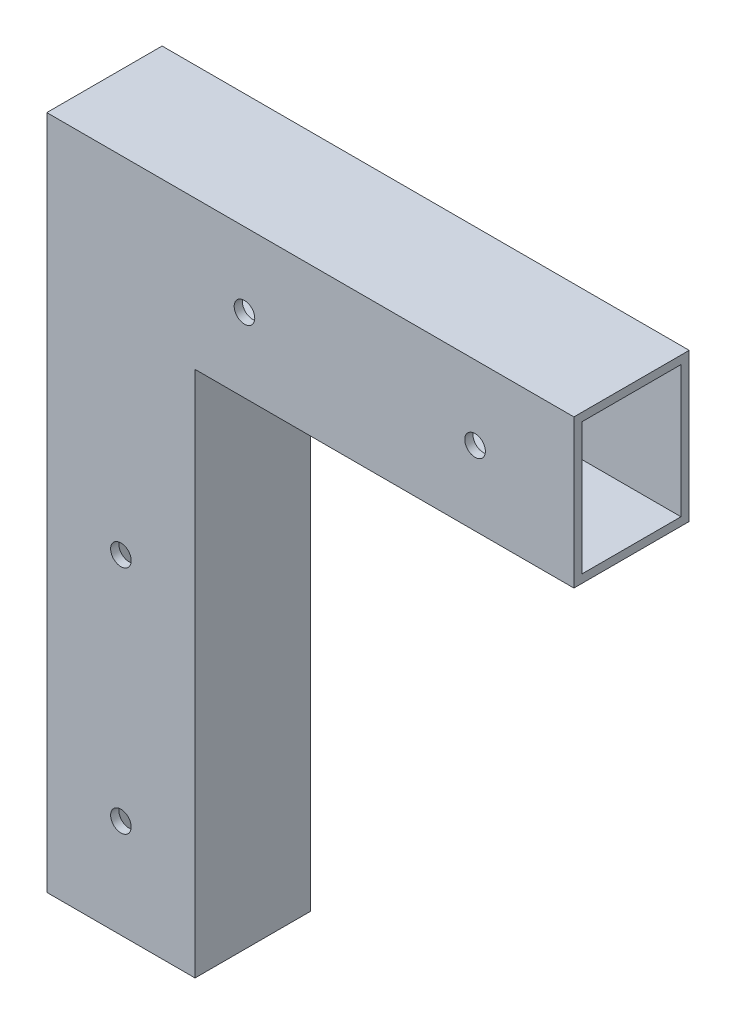
from build123d import *

# Parameters (mm, degrees)
SKETCH1_W           = 114.3
SKETCH1_H           = 406.4
BOSS_EXTRUDE1_DEPTH = 88.9
SKETCH2_W           = 406.4
SKETCH2_H           = 88.9
BOSS_EXTRUDE2_DEPTH = 114.3
SKETCH3_W           = 76.2
SKETCH3_H           = 101.6
CUT_EXTRUDE1_DEPTH  = 400.05
SKETCH4_W           = 101.6
SKETCH4_H           = 76.2
CUT_EXTRUDE3_DEPTH  = 400.05
SKETCH5_R           = 7.9375
CUT_EXTRUDE4_DEPTH  = 400.05
SKETCH6_R           = 7.9375
CUT_EXTRUDE5_DEPTH  = 400.05


with BuildPart() as part:
    # Sketch1 → Boss-Extrude1 (new body)
    with BuildSketch(Plane.XY):
        Rectangle(SKETCH1_W, SKETCH1_H)
    extrude(amount=BOSS_EXTRUDE1_DEPTH)

    # Sketch2 → Boss-Extrude2 (add)
    with BuildSketch(Plane(origin=(0, 203.2, 0), x_dir=(1, 0, 0), z_dir=(0, 1, 0))):
        with Locations((146.05, -44.45)):
            Rectangle(SKETCH2_W, SKETCH2_H)
    extrude(amount=BOSS_EXTRUDE2_DEPTH)

    # Sketch3 → Cut-Extrude1 (cut)
    with BuildSketch(Plane(origin=(349.25, 0, 0), x_dir=(0, 0, -1), z_dir=(1, 0, 0))):
        with Locations((-44.45, 260.35)):
            Rectangle(SKETCH3_W, SKETCH3_H)
    extrude(amount=-CUT_EXTRUDE1_DEPTH, mode=Mode.SUBTRACT)

    # Sketch4 → Cut-Extrude3 (cut)
    with BuildSketch(Plane.XZ.offset(203.2)):
        with Locations((0, 44.45)):
            Rectangle(SKETCH4_W, SKETCH4_H)
    extrude(amount=-CUT_EXTRUDE3_DEPTH, mode=Mode.SUBTRACT)

    # Sketch5 → Cut-Extrude4 (cut)
    with BuildSketch(Plane.XY.offset(88.9)):
        with Locations((273.05, 260.35)):
            Circle(SKETCH5_R)
        with Locations((95.25, 260.35)):
            Circle(SKETCH5_R)
    extrude(amount=-CUT_EXTRUDE4_DEPTH, mode=Mode.SUBTRACT)

    # Sketch6 → Cut-Extrude5 (cut)
    with BuildSketch(Plane.XY.offset(88.9)):
        with Locations((0, -127)):
            Circle(SKETCH6_R)
        with Locations((0, 50.8)):
            Circle(SKETCH6_R)
    extrude(amount=-CUT_EXTRUDE5_DEPTH, mode=Mode.SUBTRACT)


solid = part.part
